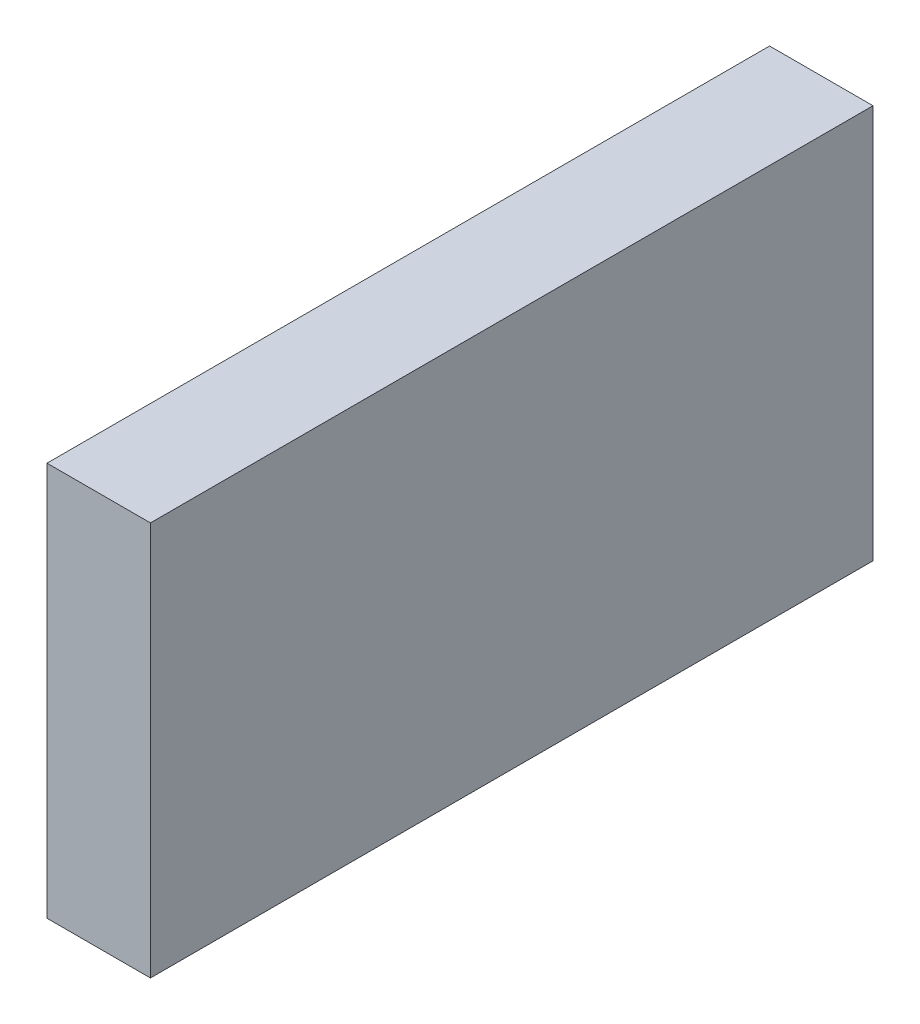
from build123d import *

# Parameters (mm, degrees)
SKETCH1_W           = 10
SKETCH1_H           = 38.1
BOSS_EXTRUDE1_DEPTH = 69.85


with BuildPart() as part:
    # Sketch1 → Boss-Extrude1 (new body)
    with BuildSketch(Plane.XY):
        with Locations((2.574096386, -3.213253012)):
            Rectangle(SKETCH1_W, SKETCH1_H)
    extrude(amount=BOSS_EXTRUDE1_DEPTH)


solid = part.part
